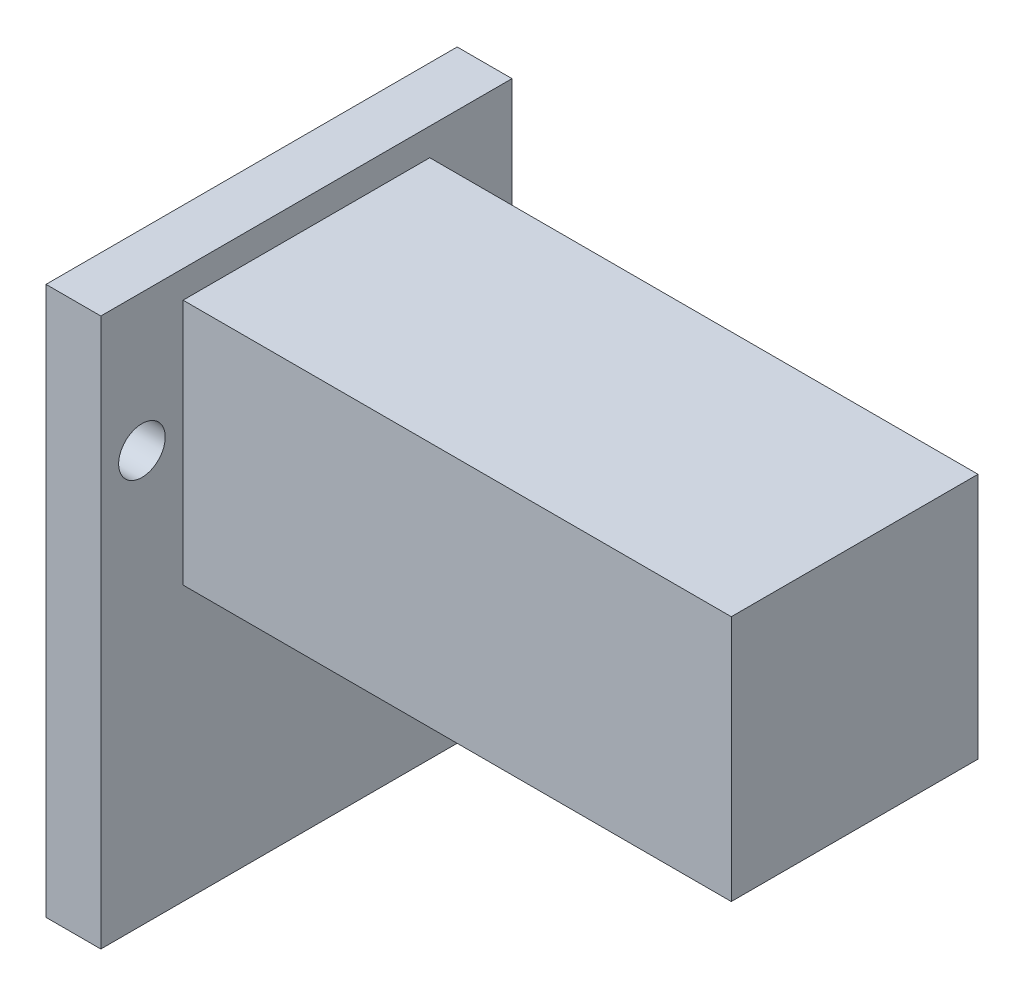
from build123d import *

# Parameters (mm, degrees)
SKETCH1_W           = 30
SKETCH1_H           = 40
BOSS_EXTRUDE1_DEPTH = 4
SKETCH2_W           = 18
SKETCH2_H           = 18
BOSS_EXTRUDE2_DEPTH = 40
SKETCH3_R           = 1.7
CUT_EXTRUDE1_DEPTH  = 53.017041145


with BuildPart() as part:
    # Sketch1 → Boss-Extrude1 (new body)
    with BuildSketch(Plane(origin=(0, 0, 0), x_dir=(0, 0, -1), z_dir=(1, 0, 0))):
        with Locations((4.583333333, -6.875)):
            Rectangle(SKETCH1_W, SKETCH1_H)
    extrude(amount=BOSS_EXTRUDE1_DEPTH)

    # Sketch2 → Boss-Extrude2 (add)
    with BuildSketch(Plane(origin=(4, 0, 0), x_dir=(0, 0, -1), z_dir=(1, 0, 0))):
        with Locations((4.583333333, 2.125)):
            Rectangle(SKETCH2_W, SKETCH2_H)
    extrude(amount=BOSS_EXTRUDE2_DEPTH)

    # Sketch3 → Cut-Extrude1 (cut, through all)
    with BuildSketch(Plane(origin=(4, 0, 0), x_dir=(0, 0, -1), z_dir=(1, 0, 0))):
        with Locations((-7.416666667, 3.125)):
            Circle(SKETCH3_R)
        with Locations((16.583333333, 3.125)):
            Circle(SKETCH3_R)
    extrude(amount=-CUT_EXTRUDE1_DEPTH, mode=Mode.SUBTRACT)


solid = part.part
